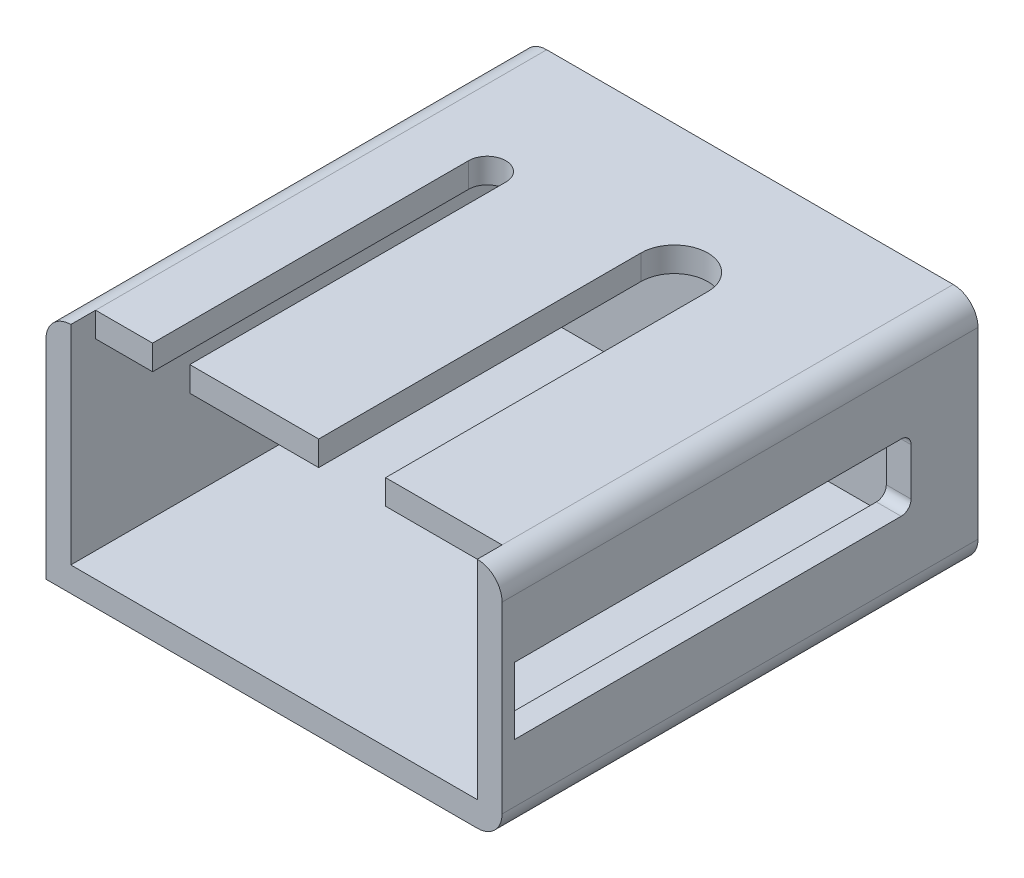
from build123d import *

# Parameters (mm, degrees)
SKETCH_1_W          = 184
SKETCH_1_H          = 94
SKETCH_1_W_2        = 164
SKETCH_1_H_2        = 74
EXTRUDE_1_DEPTH     = 192
SKETCH_2_W          = 184
SKETCH_2_H          = 94
EXTRUDE_2_DEPTH     = 10
CUT_EXTRUDE_1_REACH = 234.732
CUT_EXTRUDE_2_REACH = 272.054
CUT_EXTRUDE_3_DEPTH = 10
CUT_EXTRUDE_4_DEPTH = 10
SKETCH_8_W          = 5
SKETCH_8_H          = 26.959910705
EXTRUDE_4_DEPTH     = 10
SKETCH_9_W          = 52
SKETCH_9_H          = 10
SKETCH_9_W_2        = 23
SKETCH_9_W_3        = 47
CUT_EXTRUDE_5_DEPTH = 10
FILLET_1_R          = 10


with BuildPart() as part:
    # 草图1 → 凸台-拉伸1 (new body)
    with BuildSketch(Plane.XY):
        Rectangle(SKETCH_1_W, SKETCH_1_H)
        Rectangle(SKETCH_1_W_2, SKETCH_1_H_2, mode=Mode.SUBTRACT)
    extrude(amount=-EXTRUDE_1_DEPTH)

    # 草图2 → 凸台-拉伸2 (add)
    with BuildSketch(Plane(origin=(0, 0, -192), x_dir=(-1, 0, 0), z_dir=(0, 0, -1))):
        Rectangle(SKETCH_2_W, SKETCH_2_H)
    extrude(amount=-EXTRUDE_2_DEPTH)

    # 草图3 → 切除-拉伸1 (cut, up to next)
    with BuildSketch(Plane(origin=(0, 47, 0), x_dir=(1, 0, 0), z_dir=(0, 1, 0)), mode=Mode.PRIVATE) as cut_extrude_1_sk1:
        with BuildLine():
            Line((35, 140), (35, 40))
            ThreePointArc((35, 40), (21.5, 26.5), (8, 40))
            Line((8, 40), (8, 140))
            ThreePointArc((8, 140), (21.5, 153.5), (35, 140))
        make_face()
    cut_extrude_1_tool1 = extrude(cut_extrude_1_sk1.sketch, amount=-CUT_EXTRUDE_1_REACH, mode=Mode.PRIVATE) & part.part
    # 草图3 → 切除-拉伸1 (cut, up to next)
    with BuildSketch(Plane(origin=(0, 47, 0), x_dir=(1, 0, 0), z_dir=(0, 1, 0)), mode=Mode.PRIVATE) as cut_extrude_1_sk2:
        with BuildLine():
            Line((-59, 42.5), (-59, 137.5))
            ThreePointArc((-59, 137.5), (-51.5, 145), (-44, 137.5))
            Line((-44, 137.5), (-44, 42.5))
            ThreePointArc((-44, 42.5), (-51.5, 35), (-59, 42.5))
        make_face()
    cut_extrude_1_tool2 = extrude(cut_extrude_1_sk2.sketch, amount=-CUT_EXTRUDE_1_REACH, mode=Mode.PRIVATE) & part.part
    add(cut_extrude_1_tool1.solids().sort_by_distance((21.5, 47, -90))[0], mode=Mode.SUBTRACT)
    add(cut_extrude_1_tool2.solids().sort_by_distance((-51.5, 47, -90))[0], mode=Mode.SUBTRACT)

    # 草图4 → 切除-拉伸2 (cut, up to next)
    with BuildSketch(Plane(origin=(92, 0, 0), x_dir=(0, 0, -1), z_dir=(1, 0, 0)), mode=Mode.PRIVATE) as cut_extrude_2_sk1:
        with BuildLine():
            Line((15, 9.5), (15, -9.5))
            ThreePointArc((15, -9.5), (16.171572875, -12.328427125), (19, -13.5))
            Line((19, -13.5), (161, -13.5))
            ThreePointArc((161, -13.5), (163.828427125, -12.328427125), (165, -9.5))
            Line((165, -9.5), (165, 9.5))
            ThreePointArc((165, 9.5), (163.828427125, 12.328427125), (161, 13.5))
            Line((161, 13.5), (19, 13.5))
            ThreePointArc((19, 13.5), (16.171572875, 12.328427125), (15, 9.5))
        make_face()
    cut_extrude_2_tool1 = extrude(cut_extrude_2_sk1.sketch, amount=-CUT_EXTRUDE_2_REACH, mode=Mode.PRIVATE) & part.part
    add(cut_extrude_2_tool1.solids().sort_by_distance((92, 0, -90))[0], mode=Mode.SUBTRACT)

    # 草图5 → 切除-拉伸3 (cut)
    with BuildSketch(Plane(origin=(0, 47, 0), x_dir=(1, 0, 0), z_dir=(0, 1, 0))):
        with BuildLine():
            ThreePointArc((35, 40), (21.5, 26.5), (8, 40))
            Line((8, 40), (8, 0))
            Line((8, 0), (35, 0))
            Line((35, 0), (35, 40))
        make_face()
        with BuildLine():
            Line((-59, 0), (-44, 0))
            Line((-44, 0), (-44, 42.5))
            ThreePointArc((-44, 42.5), (-51.5, 35), (-59, 42.5))
            Line((-59, 42.5), (-59, 0))
        make_face()
    extrude(amount=-CUT_EXTRUDE_3_DEPTH, mode=Mode.SUBTRACT)

    # 草图7 → 切除-拉伸4 (cut)
    with BuildSketch(Plane(origin=(92, 0, 0), x_dir=(0, 0, -1), z_dir=(1, 0, 0))):
        Polygon((18.435104252, 13.459910705), (-12.830882311, 13.459910705), (-16.882855926, -13.5), (19, -13.5), align=None)
    extrude(amount=-CUT_EXTRUDE_4_DEPTH, mode=Mode.SUBTRACT)

    # 草图8 → 凸台-拉伸4 (add)
    with BuildSketch(Plane(origin=(92, 0, 0), x_dir=(0, 0, -1), z_dir=(1, 0, 0))):
        with Locations((2.5, -0.020044647)):
            Rectangle(SKETCH_8_W, SKETCH_8_H)
    extrude(amount=-EXTRUDE_4_DEPTH)

    # 草图9 → 切除-拉伸5 (cut)
    with BuildSketch(Plane(origin=(0, 47, 0), x_dir=(1, 0, 0), z_dir=(0, 1, 0))):
        with Locations((-18, 5)):
            Rectangle(SKETCH_9_W, SKETCH_9_H)
        with Locations((-70.5, 5)):
            Rectangle(SKETCH_9_W_2, SKETCH_9_H)
        with Locations((58.5, 5)):
            Rectangle(SKETCH_9_W_3, SKETCH_9_H)
    extrude(amount=-CUT_EXTRUDE_5_DEPTH, mode=Mode.SUBTRACT)

    # 圆角1
    fillet_1_edges = [part.edges().sort_by_distance(p)[0] for p in [
        (-92, 47, -96),
        (92, 47, -96),
        (92, -47, -96),
    ]]
    fillet(fillet_1_edges, radius=FILLET_1_R)


solid = part.part
